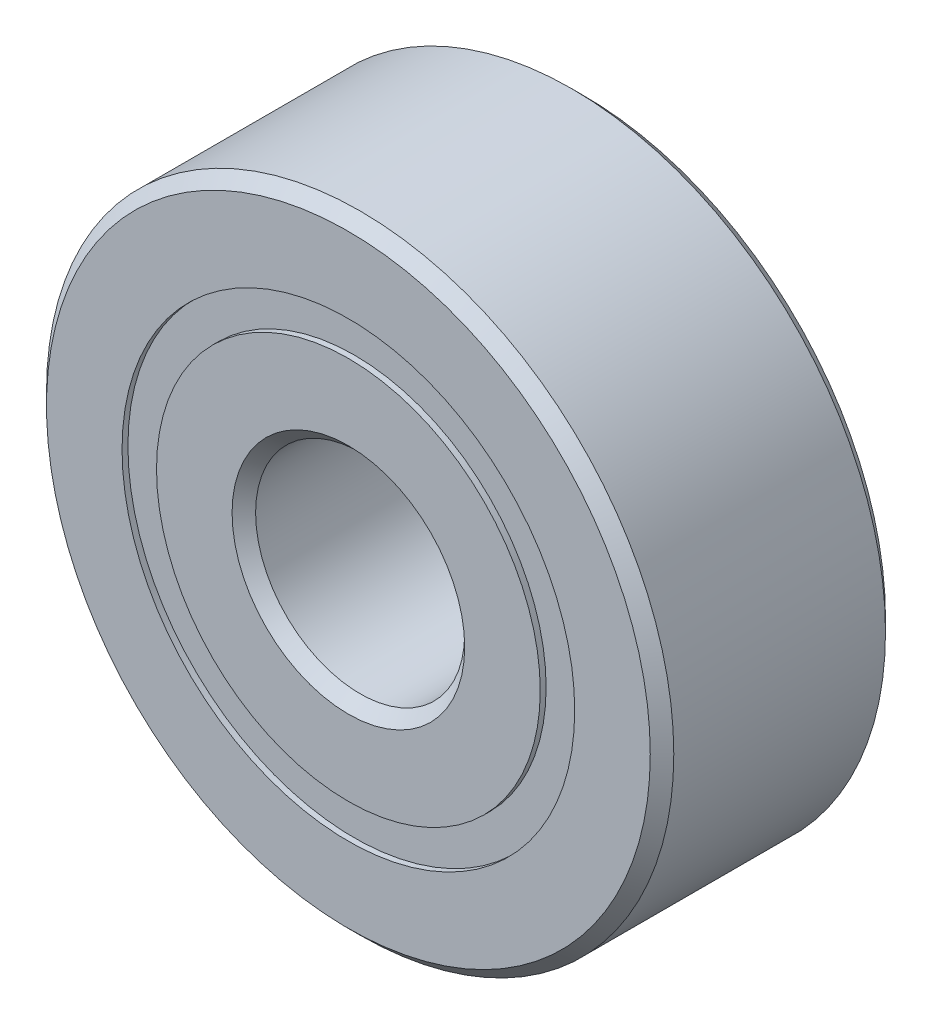
from build123d import *

# Parameters (mm, degrees)
SKETCH5_W = 1.721739088
SKETCH5_H = 1.046703296


with BuildPart() as part:
    # Sketch1 → Revolve1 (revolve)
    with BuildSketch(Plane(origin=(0, 0, 0), x_dir=(0, 0, -1), z_dir=(1, 0, 0))):
        with BuildLine():
            Line((3.2146875, 9.525), (-3.2146875, 9.525))
            Line((-3.2146875, 9.525), (-3.571875, 9.1678125))
            Line((-3.571875, 9.1678125), (-3.571875, 6.873351648))
            Line((-3.571875, 6.873351648), (-1.5875, 6.873351648))
            ThreePointArc((-1.5875, 6.873351648), (0, 8.021542162), (1.5875, 6.873351648))
            Line((1.5875, 6.873351648), (3.571875, 6.873351648))
            Line((3.571875, 6.873351648), (3.571875, 9.1678125))
            Line((3.571875, 9.1678125), (3.2146875, 9.525))
        make_face()
    revolve(axis=Axis((0, 0, 3.571875), (0, 0, -1)))


with BuildPart() as body_2:
    # Sketch3 → Revolve3 (revolve)
    with BuildSketch(Plane(origin=(0, 0, 0), x_dir=(0, 0, -1), z_dir=(1, 0, 0))):
        with BuildLine():
            Line((-3.571875, 5.826648352), (-1.5875, 5.826648352))
            ThreePointArc((-1.5875, 5.826648352), (0, 4.678457838), (1.5875, 5.826648352))
            Line((1.5875, 5.826648352), (3.571875, 5.826648352))
            Line((3.571875, 5.826648352), (3.571875, 3.5321875))
            Line((3.571875, 3.5321875), (3.2146875, 3.175))
            Line((3.2146875, 3.175), (-3.2146875, 3.175))
            Line((-3.2146875, 3.175), (-3.571875, 3.5321875))
            Line((-3.571875, 3.5321875), (-3.571875, 5.826648352))
        make_face()
    revolve(axis=Axis((0, 0, 3.571875), (0, 0, -1)))


with BuildPart() as body_3:
    # Sketch5 → Revolve5 (revolve)
    with BuildSketch(Plane(origin=(0, 0, 0), x_dir=(0, 0, -1), z_dir=(1, 0, 0))):
        with Locations((-2.532411706, 6.35)):
            Rectangle(SKETCH5_W, SKETCH5_H)
        with Locations((2.532411706, 6.35)):
            Rectangle(SKETCH5_W, SKETCH5_H)
    revolve(axis=Axis((0, 0, 3.571875), (0, 0, -1)))


solid = Compound([part.part, body_2.part, body_3.part])
